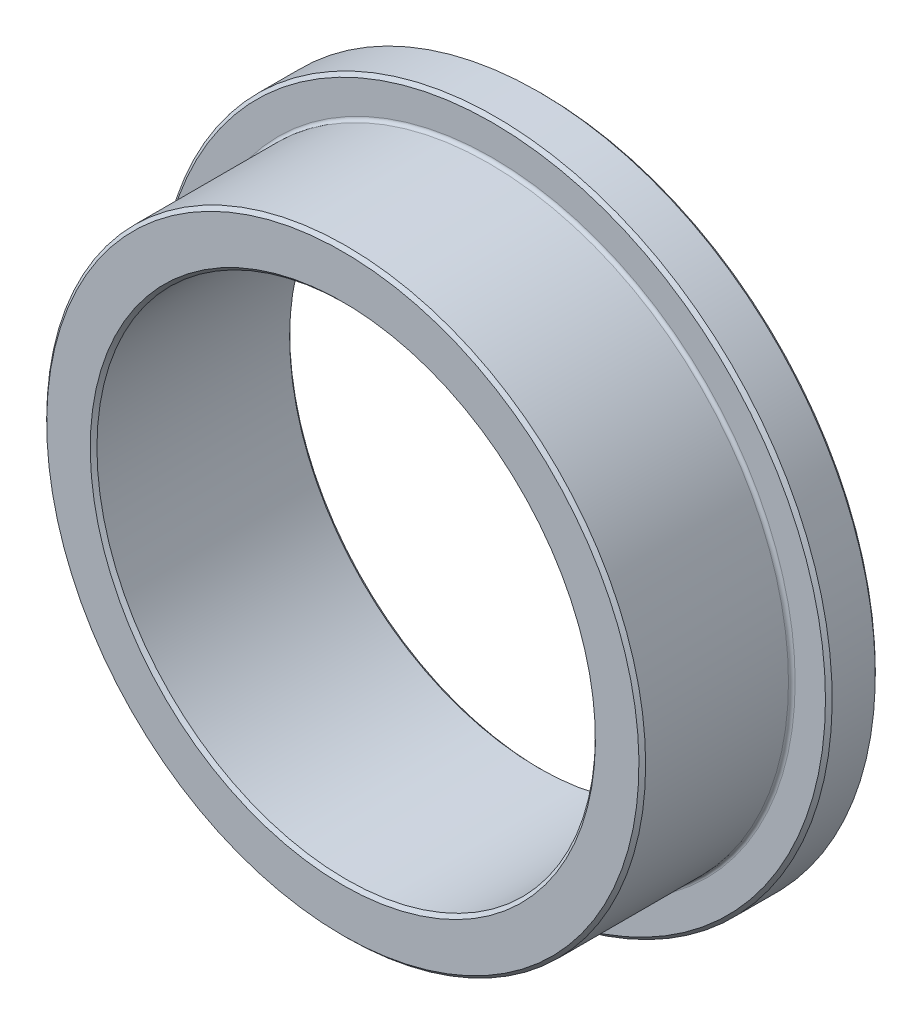
from build123d import *

# Parameters (mm, degrees)
FILLET1_SIZE = 0.21336
FILLET2_R    = 0.21336


with BuildPart() as part:
    # Sketch4 → Revolve1 (revolve)
    with BuildSketch(Plane(origin=(0, 0, 0), x_dir=(0, 0, -1), z_dir=(1, 0, 0))):
        Polygon((3.175, -21.43125), (6.35, -21.43125), (6.35, -15.875), (-6.35, -15.875), (-6.35, -19.0754), (3.175, -19.0754), align=None)
    revolve(axis=Axis((0, 0, 6.35), (0, 0, -1)))

    # Fillet1
    fillet1_edges = [part.edges().sort_by_distance(p)[0] for p in [
        (0, 19.0754, 6.35),
        (0, 15.875, 6.35),
        (0, 15.875, -6.35),
        (0, 21.43125, -6.35),
        (0, 21.43125, -3.175),
    ]]
    chamfer(fillet1_edges, length=FILLET1_SIZE)

    # Fillet2
    fillet2_edges = [part.edges().sort_by_distance(p)[0] for p in [
        (0, 19.0754, -3.175),
    ]]
    fillet(fillet2_edges, radius=FILLET2_R)


solid = part.part
